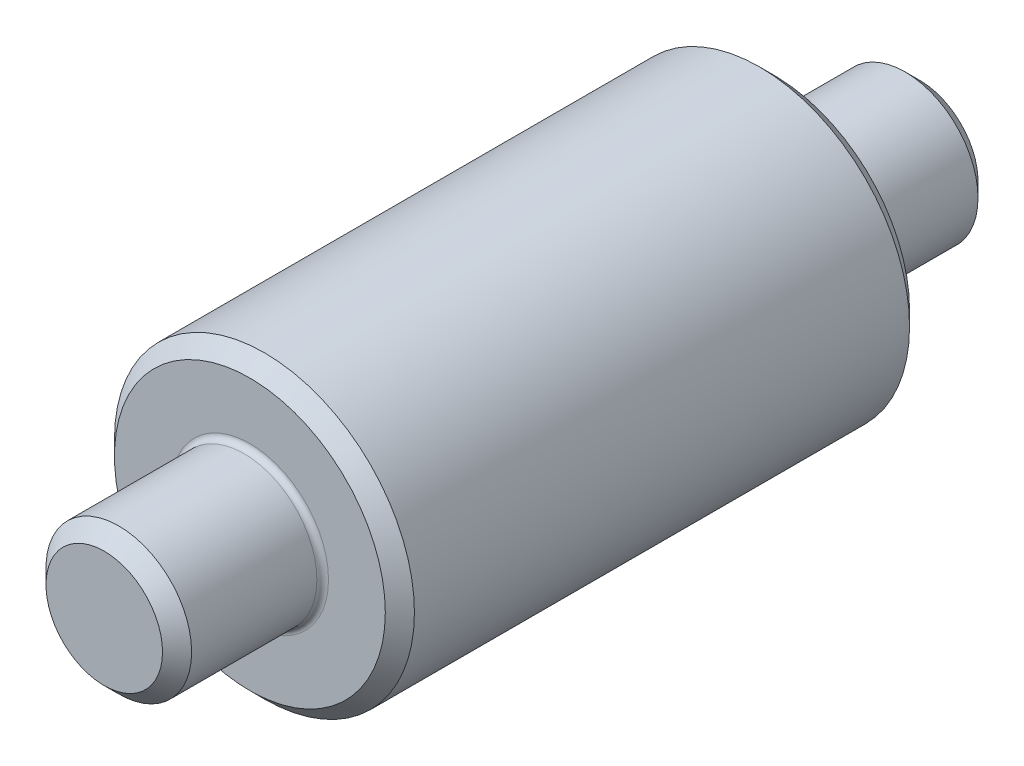
from build123d import *

# Parameters (mm, degrees)
BOSS_EXTRUDE1_DEPTH      = 9
BOSS_EXTRUDE1_DEPTH_BACK = 9
SKETCH1_R                = 5.15
SKETCH2_R                = 2.5
BOSS_EXTRUDE2_DEPTH      = 5
BOSS_EXTRUDE3_START      = 5
SKETCH3_R                = 2.5
BOSS_EXTRUDE3_DEPTH      = 5
CHAMFER2_SIZE            = 0.5
FILLET1_R                = 0.2


with BuildPart() as part:
    # Sketch1 → Boss-Extrude1 (new, two sides: drawn at the far end of the back side and taken through both)
    with BuildSketch(Plane.XY.offset(-BOSS_EXTRUDE1_DEPTH_BACK)):
        Circle(SKETCH1_R)
    extrude(amount=BOSS_EXTRUDE1_DEPTH + BOSS_EXTRUDE1_DEPTH_BACK)

    # Sketch2 → Boss-Extrude2 (add)
    with BuildSketch(Plane.XY.offset(9)):
        Circle(SKETCH2_R)
    extrude(amount=BOSS_EXTRUDE2_DEPTH)

    # Sketch3 → Boss-Extrude3 (add)
    with BuildSketch(Plane(origin=(0, 0, -9), x_dir=(-1, 0, 0), z_dir=(0, 0, -1)).offset(BOSS_EXTRUDE3_START)):
        Circle(SKETCH3_R)
    extrude(amount=-BOSS_EXTRUDE3_DEPTH)

    # Chamfer2
    chamfer2_edges = [part.edges().sort_by_distance(p)[0] for p in [
        (2.5, 0, -14),
        (-2.5, 0, 14),
        (-5.15, 0, -9),
        (-5.15, 0, 9),
    ]]
    chamfer(chamfer2_edges, length=CHAMFER2_SIZE)

    # Fillet1
    fillet1_edges = [part.edges().sort_by_distance(p)[0] for p in [
        (2.5, 0, -9),
        (-2.5, 0, 9),
    ]]
    fillet(fillet1_edges, radius=FILLET1_R)


solid = part.part
